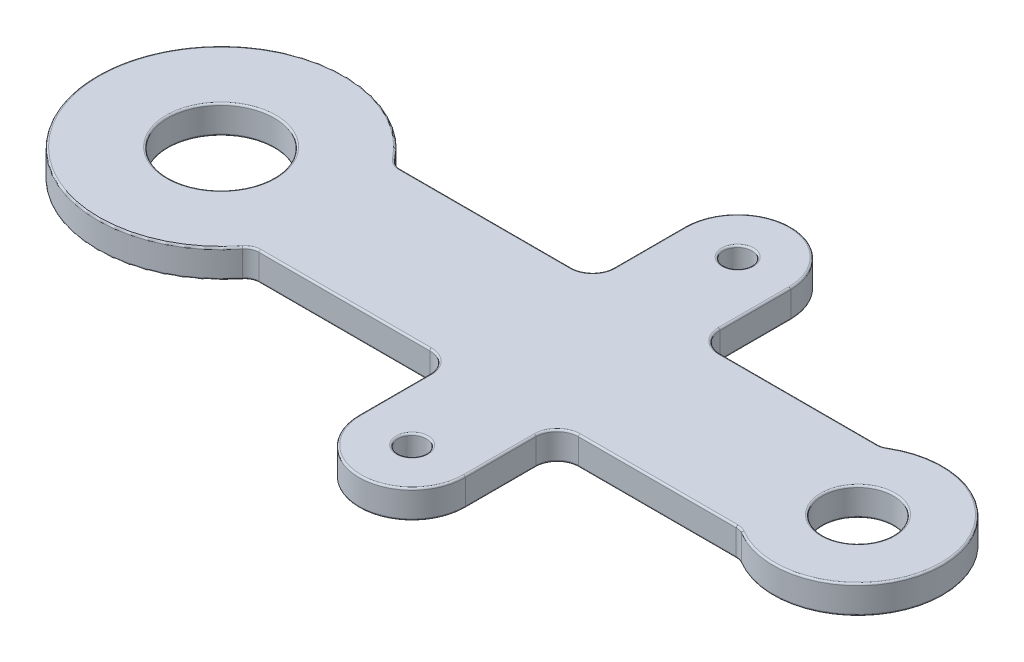
from build123d import *

# Parameters (mm, degrees)
SKETCH_1_R      = 15
SKETCH_1_R_2    = 4
SKETCH_1_R_3    = 10
EXTRUDE_1_DEPTH = 8
FILLET_3_R      = 6
FILLET_4_R      = 6
FILLET_5_R      = 6
FILLET_6_R      = 6
FILLET_8_R      = 4
FILLET_9_R      = 4
FILLET_10_R     = 4
FILLET_11_R     = 4
FILLET_12_R     = 0.5


with BuildPart() as part:
    # 草图1 → 凸台-拉伸1 (new body)
    with BuildSketch(Plane(origin=(0, 0, 0), x_dir=(1, 0, 0), z_dir=(0, 1, 0))):
        with BuildLine():
            Line((28.719409623, 20.004887175), (85, 20.004887175))
            Line((85, 20.004887175), (85, 46))
            ThreePointArc((85, 46), (100, 61), (115, 46))
            Line((115, 46), (115, 20.004887175))
            Line((115, 20.004887175), (166.74087148, 20.004887175))
            ThreePointArc((166.74087148, 20.004887175), (204, 0), (166.74087148, -20.004887175))
            Line((166.74087148, -20.004887175), (115, -20.004887175))
            Line((115, -20.004887175), (115, -46))
            ThreePointArc((115, -46), (100, -61), (85, -46))
            Line((85, -46), (85, -20.004887175))
            Line((85, -20.004887175), (28.719409623, -20.004887175))
            ThreePointArc((28.719409623, -20.004887175), (-35, 0), (28.719409623, 20.004887175))
        make_face()
        with Locations(Location((0, 0, 0), (0, 0, 270))):
            Circle(SKETCH_1_R, mode=Mode.SUBTRACT)
        with Locations(Location((100, 46, 0), (0, 0, 270))):
            Circle(SKETCH_1_R_2, mode=Mode.SUBTRACT)
        with Locations(Location((180, 0, 0), (0, 0, 270))):
            Circle(SKETCH_1_R_3, mode=Mode.SUBTRACT)
        with Locations(Location((100, -46, 0), (0, 0, 90))):
            Circle(SKETCH_1_R_2, mode=Mode.SUBTRACT)
    extrude(amount=EXTRUDE_1_DEPTH)

    # 圆角3
    fillet_3_edges = [part.edges().sort_by_distance(p)[0] for p in [
        (115, 4, 20.004887175),
    ]]
    fillet(fillet_3_edges, radius=FILLET_3_R)

    # 圆角4
    fillet_4_edges = [part.edges().sort_by_distance(p)[0] for p in [
        (85, 4, 20.004887175),
    ]]
    fillet(fillet_4_edges, radius=FILLET_4_R)

    # 圆角5
    fillet_5_edges = [part.edges().sort_by_distance(p)[0] for p in [
        (85, 4, -20.004887175),
    ]]
    fillet(fillet_5_edges, radius=FILLET_5_R)

    # 圆角6
    fillet_6_edges = [part.edges().sort_by_distance(p)[0] for p in [
        (115, 4, -20.004887175),
    ]]
    fillet(fillet_6_edges, radius=FILLET_6_R)

    # 圆角8
    fillet_8_edges = [part.edges().sort_by_distance(p)[0] for p in [
        (166.74087148, 4, -20.004887175),
    ]]
    fillet(fillet_8_edges, radius=FILLET_8_R)

    # 圆角9
    fillet_9_edges = [part.edges().sort_by_distance(p)[0] for p in [
        (166.74087148, 4, 20.004887175),
    ]]
    fillet(fillet_9_edges, radius=FILLET_9_R)

    # 圆角10
    fillet_10_edges = [part.edges().sort_by_distance(p)[0] for p in [
        (28.719409623, 4, 20.004887175),
    ]]
    fillet(fillet_10_edges, radius=FILLET_10_R)

    # 圆角11
    fillet_11_edges = [part.edges().sort_by_distance(p)[0] for p in [
        (28.719409623, 4, -20.004887175),
    ]]
    fillet(fillet_11_edges, radius=FILLET_11_R)

    # 圆角12
    fillet_12_edges = [part.edges().sort_by_distance(p)[0] for p in [
        (166.654322464, 0, -20.150209602),
        (204, 0, 0),
        (204, 8, 0),
        (166.654322464, 0, 20.150209602),
        (166.654322464, 8, 20.150209602),
        (85, 0, -36.002443588),
        (100, 0, -61),
        (54.868518078, 0, 20.004887175),
        (54.868518078, 8, 20.004887175),
        (28.983205897, 8, 20.409879606),
        (28.983205897, 0, 20.409879606),
        (100, 8, 61),
        (-35, 0, 0),
        (-35, 8, 0),
        (28.983205897, 0, -20.409879606),
        (28.983205897, 8, -20.409879606),
        (115, 0, 36.002443588),
        (100, 0, 61),
        (115, 8, 36.002443588),
        (0, 0, -15),
        (0, 8, -15),
        (100, 8, -61),
        (100, 0, -50),
        (100, 8, -50),
        (85, 8, -36.002443588),
        (180, 0, -10),
        (180, 8, -10),
        (100, 0, 50),
        (100, 8, 50),
        (143.292965386, 0, 20.004887175),
        (143.292965386, 8, 20.004887175),
        (116.757359313, 0, 21.762246488),
        (116.757359313, 8, 21.762246488),
        (85, 0, 36.002443588),
        (85, 8, 36.002443588),
        (83.242640687, 8, 21.762246488),
        (83.242640687, 0, 21.762246488),
        (54.868518078, 0, -20.004887175),
        (54.868518078, 8, -20.004887175),
        (83.242640687, 0, -21.762246488),
        (83.242640687, 8, -21.762246488),
        (115, 0, -36.002443588),
        (115, 8, -36.002443588),
        (116.757359313, 8, -21.762246488),
        (116.757359313, 0, -21.762246488),
        (143.292965386, 0, -20.004887175),
        (143.292965386, 8, -20.004887175),
        (166.654322464, 8, -20.150209602),
    ]]
    fillet(fillet_12_edges, radius=FILLET_12_R)


solid = part.part
